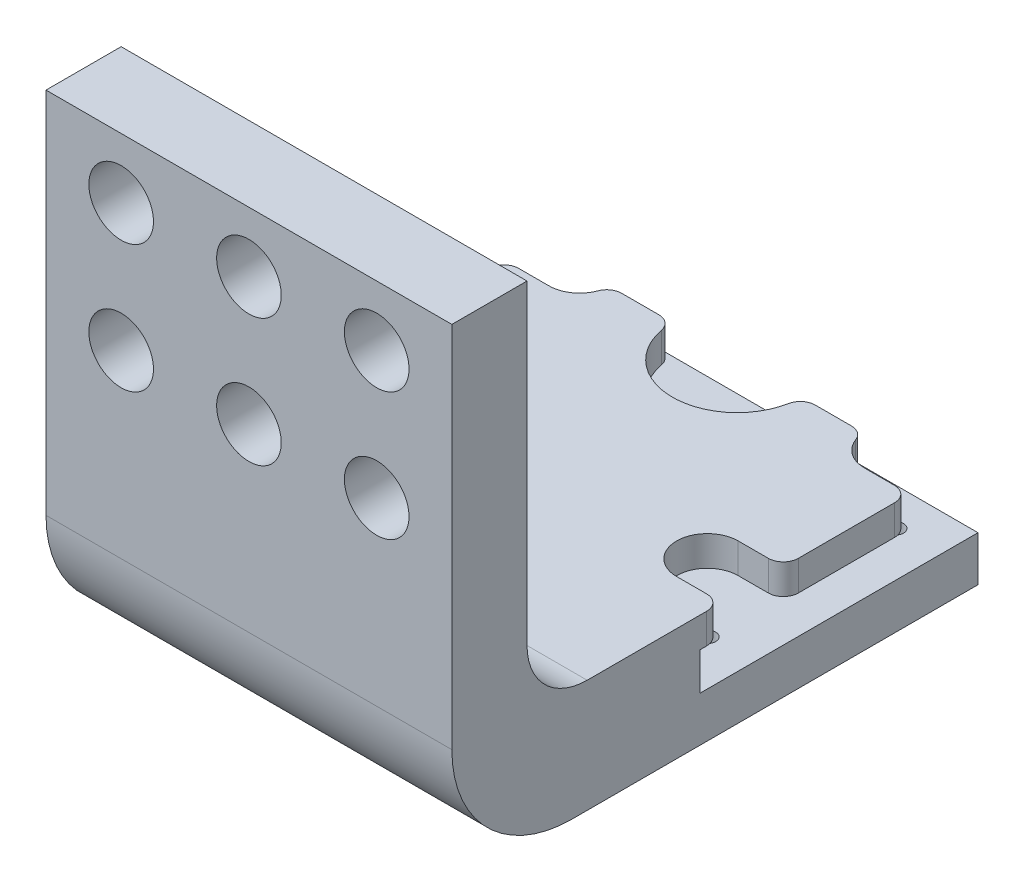
from build123d import *
from OCP.BRepFilletAPI import BRepFilletAPI_MakeFillet

# Parameters (mm, degrees)
DODANIE_WYCI_GNI_CIE1_DEPTH = 27
WYTNIJ_WYCI_GNI_CIE1_REACH  = 71.794
SZKIC2_R                    = 0.55
WYTNIJ_WYCI_GNI_CIE2_START  = -7.5
SZKIC2_3_R                  = 4.3
SZKIC2_3_R_2                = 2.05
WYTNIJ_WYCI_GNI_CIE2_DEPTH  = 2
WYTNIJ_WYCI_GNI_CIE3_REACH  = 68.633
ZAOKR_GLENIE1_R             = 1
ZAOKR_GLENIE2_R1            = 8
ZAOKR_GLENIE2_R2            = 4
OTW_R_POD_RUB_M41_D         = 4.3


with BuildPart() as part:
    # Szkic1 → Dodanie-wyciągnięcie1 (new body)
    with BuildSketch(Plane(origin=(0, 0, 0), x_dir=(0, 0, -1), z_dir=(1, 0, 0))):
        Polygon((-20.551283841, -19.152030835), (-39.051283841, -19.152030835), (-39.051283841, -16.652030835), (-23.109904513, -16.652030835), (-23.109904513, -14.652030835), (-50.551283841, -14.652030835), (-50.551283841, 10.347969165), (-55.551283841, 10.347969165), (-55.551283841, -22.152030835), (-20.551283841, -22.152030835), align=None)
    extrude(amount=-DODANIE_WYCI_GNI_CIE1_DEPTH)

    # Szkic2 → Wytnij-wyciągnięcie1 (cut, up to next)
    with BuildSketch(Plane.XZ.offset(22.152030835), mode=Mode.PRIVATE) as wytnij_wyci_gni_cie1_sk1:
        with Locations(Location((-3, 23.051283841, 0), (0, 0, 270))):
            Circle(SZKIC2_R)
    wytnij_wyci_gni_cie1_tool1 = extrude(wytnij_wyci_gni_cie1_sk1.sketch, amount=-WYTNIJ_WYCI_GNI_CIE1_REACH, mode=Mode.PRIVATE) & part.part
    # Szkic2 → Wytnij-wyciągnięcie1 (cut, up to next)
    with BuildSketch(Plane.XZ.offset(22.152030835), mode=Mode.PRIVATE) as wytnij_wyci_gni_cie1_sk2:
        with Locations(Location((-3, 35.551283841, 0), (0, 0, 270))):
            Circle(SZKIC2_R)
    wytnij_wyci_gni_cie1_tool2 = extrude(wytnij_wyci_gni_cie1_sk2.sketch, amount=-WYTNIJ_WYCI_GNI_CIE1_REACH, mode=Mode.PRIVATE) & part.part
    # Szkic2 → Wytnij-wyciągnięcie1 (cut, up to next)
    with BuildSketch(Plane.XZ.offset(22.152030835), mode=Mode.PRIVATE) as wytnij_wyci_gni_cie1_sk3:
        with Locations(Location((-24, 35.551283841, 0), (0, 0, 270))):
            Circle(SZKIC2_R)
    wytnij_wyci_gni_cie1_tool3 = extrude(wytnij_wyci_gni_cie1_sk3.sketch, amount=-WYTNIJ_WYCI_GNI_CIE1_REACH, mode=Mode.PRIVATE) & part.part
    # Szkic2 → Wytnij-wyciągnięcie1 (cut, up to next)
    with BuildSketch(Plane.XZ.offset(22.152030835), mode=Mode.PRIVATE) as wytnij_wyci_gni_cie1_sk4:
        with Locations(Location((-24, 23.051283841, 0), (0, 0, 270))):
            Circle(SZKIC2_R)
    wytnij_wyci_gni_cie1_tool4 = extrude(wytnij_wyci_gni_cie1_sk4.sketch, amount=-WYTNIJ_WYCI_GNI_CIE1_REACH, mode=Mode.PRIVATE) & part.part
    add(wytnij_wyci_gni_cie1_tool1.solids().sort_by_distance((-3, -22.152031, 23.051284))[0], mode=Mode.SUBTRACT)
    add(wytnij_wyci_gni_cie1_tool2.solids().sort_by_distance((-3, -22.152031, 35.551284))[0], mode=Mode.SUBTRACT)
    add(wytnij_wyci_gni_cie1_tool3.solids().sort_by_distance((-24, -22.152031, 35.551284))[0], mode=Mode.SUBTRACT)
    add(wytnij_wyci_gni_cie1_tool4.solids().sort_by_distance((-24, -22.152031, 23.051284))[0], mode=Mode.SUBTRACT)

    # Szkic2<3> → Wytnij-wyciągnięcie2 (cut)
    with BuildSketch(Plane.XZ.offset(22.152030835).offset(WYTNIJ_WYCI_GNI_CIE2_START)):
        with Locations((-13.468476265, 23.109904513)):
            Circle(SZKIC2_3_R)
        with Locations((-3, 23.051283841)):
            Circle(SZKIC2_3_R_2)
        with Locations((-24, 23.051283841)):
            Circle(SZKIC2_3_R_2)
        with Locations(Location((-24, 35.551283841, 0), (0, 0, 270))):
            Circle(SZKIC2_3_R_2)
        with Locations(Location((-3, 35.551283841, 0), (0, 0, 270))):
            Circle(SZKIC2_3_R_2)
    extrude(amount=WYTNIJ_WYCI_GNI_CIE2_DEPTH, mode=Mode.SUBTRACT)

    # Szkic3 → Wytnij-wyciągnięcie3 (cut, up to next)
    with BuildSketch(Plane(origin=(0, -14.652030835, 0), x_dir=(1, 0, 0), z_dir=(0, 1, 0)), mode=Mode.PRIVATE) as wytnij_wyci_gni_cie3_sk1:
        with BuildLine():
            ThreePointArc((-24, -37.601283841), (-26.05, -35.551283841), (-24, -33.501283841))
            Line((-24, -33.501283841), (-27, -33.501283841))
            Line((-27, -33.501283841), (-27, -37.601283841))
            Line((-27, -37.601283841), (-24, -37.601283841))
        make_face()
    wytnij_wyci_gni_cie3_tool1 = extrude(wytnij_wyci_gni_cie3_sk1.sketch, amount=-WYTNIJ_WYCI_GNI_CIE3_REACH, mode=Mode.PRIVATE) & part.part
    # Szkic3 → Wytnij-wyciągnięcie3 (cut, up to next)
    with BuildSketch(Plane(origin=(0, -14.652030835, 0), x_dir=(1, 0, 0), z_dir=(0, 1, 0)), mode=Mode.PRIVATE) as wytnij_wyci_gni_cie3_sk2:
        with BuildLine():
            Line((-27, -23.109904513), (-27, -25.101283841))
            Line((-27, -25.101283841), (-24, -25.101283841))
            ThreePointArc((-24, -25.101283841), (-25.428693043, -24.521432197), (-26.049161686, -23.109904513))
            Line((-26.049161686, -23.109904513), (-27, -23.109904513))
        make_face()
    wytnij_wyci_gni_cie3_tool2 = extrude(wytnij_wyci_gni_cie3_sk2.sketch, amount=-WYTNIJ_WYCI_GNI_CIE3_REACH, mode=Mode.PRIVATE) & part.part
    # Szkic3 → Wytnij-wyciągnięcie3 (cut, up to next)
    with BuildSketch(Plane(origin=(0, -14.652030835, 0), x_dir=(1, 0, 0), z_dir=(0, 1, 0)), mode=Mode.PRIVATE) as wytnij_wyci_gni_cie3_sk3:
        with BuildLine():
            Line((-3, -25.101283841), (0, -25.101283841))
            Line((0, -25.101283841), (0, -23.109904513))
            Line((0, -23.109904513), (-0.950838314, -23.109904513))
            ThreePointArc((-0.950838314, -23.109904513), (-1.571306957, -24.521432197), (-3, -25.101283841))
        make_face()
    wytnij_wyci_gni_cie3_tool3 = extrude(wytnij_wyci_gni_cie3_sk3.sketch, amount=-WYTNIJ_WYCI_GNI_CIE3_REACH, mode=Mode.PRIVATE) & part.part
    # Szkic3 → Wytnij-wyciągnięcie3 (cut, up to next)
    with BuildSketch(Plane(origin=(0, -14.652030835, 0), x_dir=(1, 0, 0), z_dir=(0, 1, 0)), mode=Mode.PRIVATE) as wytnij_wyci_gni_cie3_sk4:
        with BuildLine():
            Line((0, -33.501283841), (-3, -33.501283841))
            ThreePointArc((-3, -33.501283841), (-1.550431099, -34.101714939), (-0.95, -35.551283841))
            ThreePointArc((-0.95, -35.551283841), (-1.550431099, -37.000852742), (-3, -37.601283841))
            Line((-3, -37.601283841), (0, -37.601283841))
            Line((0, -37.601283841), (0, -33.501283841))
        make_face()
    wytnij_wyci_gni_cie3_tool4 = extrude(wytnij_wyci_gni_cie3_sk4.sketch, amount=-WYTNIJ_WYCI_GNI_CIE3_REACH, mode=Mode.PRIVATE) & part.part
    add(wytnij_wyci_gni_cie3_tool1.solids().sort_by_distance((-26.229723, -14.652031, 35.551284))[0], mode=Mode.SUBTRACT)
    add(wytnij_wyci_gni_cie3_tool2.solids().sort_by_distance((-26.223837, -14.652031, 24.279211))[0], mode=Mode.SUBTRACT)
    add(wytnij_wyci_gni_cie3_tool3.solids().sort_by_distance((-0.776163, -14.652031, 24.279211))[0], mode=Mode.SUBTRACT)
    add(wytnij_wyci_gni_cie3_tool4.solids().sort_by_distance((-0.770277, -14.652031, 35.551284))[0], mode=Mode.SUBTRACT)

    # Zaokrąglenie1
    zaokr_glenie1_edges = [part.edges().sort_by_distance(p)[0] for p in [
        (-27, -15.652030835, 25.101283841),
        (-27, -15.652030835, 33.501283841),
        (-27, -15.652030835, 37.601283841),
        (-5.049161686, -15.652030835, 23.109904513),
        (-21.950838314, -15.652030835, 23.109904513),
        (-9.168476265, -15.652030835, 23.109904513),
        (-17.768476265, -15.652030835, 23.109904513),
        (0, -15.652030835, 33.501283841),
        (0, -15.652030835, 37.601283841),
        (0, -15.652030835, 25.101283841),
    ]]
    fillet(zaokr_glenie1_edges, radius=ZAOKR_GLENIE1_R)

    # Zaokrąglenie2: one fillet with a radius per group of edges: ONE call of the kernel's fillet builder (fillet() takes one radius for all edges)
    zaokr_glenie2_edges_1 = [part.edges().sort_by_distance(p)[0] for p in [
        (-13.5, -22.152030835, 55.551283841),
    ]]
    zaokr_glenie2_edges_2 = [part.edges().sort_by_distance(p)[0] for p in [
        (-13.5, -14.652030835, 50.551283841),
    ]]
    zaokr_glenie2 = BRepFilletAPI_MakeFillet(part.part.solid().wrapped)
    for e in zaokr_glenie2_edges_1:
        zaokr_glenie2.Add(ZAOKR_GLENIE2_R1, e.wrapped)
    for e in zaokr_glenie2_edges_2:
        zaokr_glenie2.Add(ZAOKR_GLENIE2_R2, e.wrapped)
    add(Compound.cast(zaokr_glenie2.Shape()), mode=Mode.REPLACE)

    # Otwór pod śrubę M41 (through all)
    with Locations(Plane(origin=(0, 0, 50.551283841), x_dir=(-1, 0, 0), z_dir=(0, 0, -1))):
        with Locations((22, -2.152030835), (13.5, -2.152030835), (5, -2.152030835), (5, 6.347969165), (13.5, 6.347969165), (22, 6.347969165)):
            Hole(OTW_R_POD_RUB_M41_D / 2)


solid = part.part
